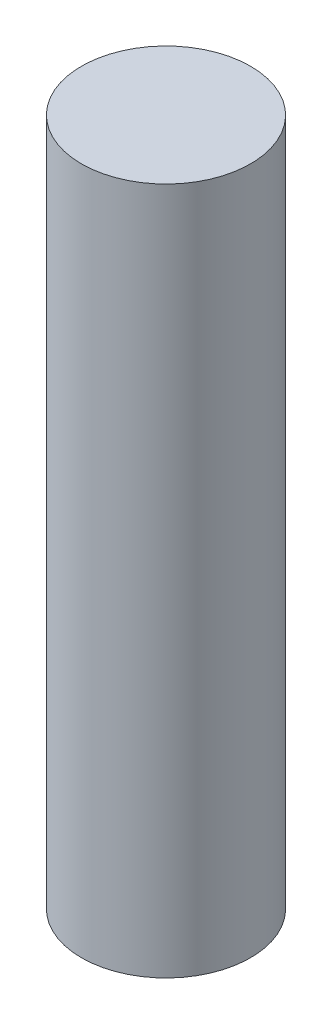
from build123d import *

# Parameters (mm, degrees)
SKETCH1_R           = 12.3
BOSS_EXTRUDE1_DEPTH = 100


with BuildPart() as part:
    # Sketch1 → Boss-Extrude1 (new body)
    with BuildSketch(Plane(origin=(0, 0, 0), x_dir=(1, 0, 0), z_dir=(0, 1, 0))):
        with Locations(Location((0, 0, 0), (0, 0, 270))):
            Circle(SKETCH1_R)
    extrude(amount=BOSS_EXTRUDE1_DEPTH)


solid = part.part
